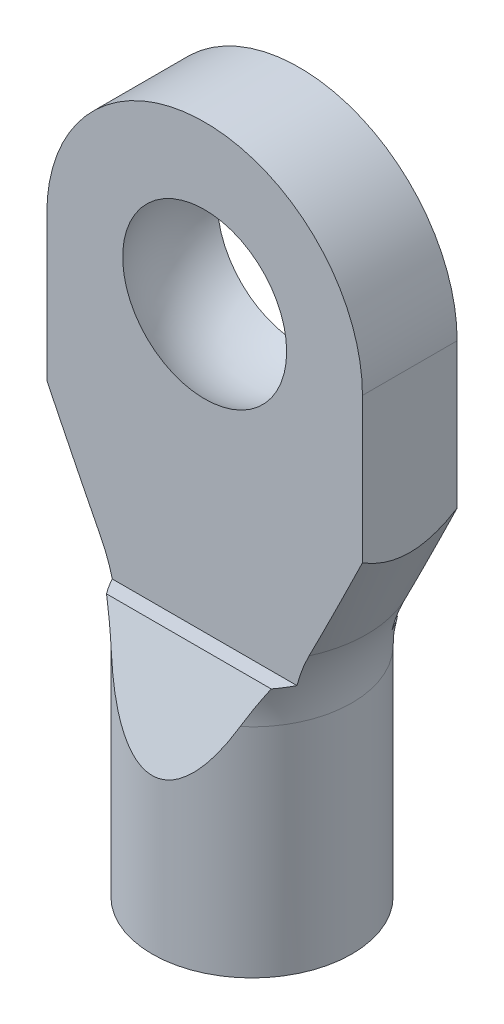
from build123d import *

# Parameters (mm, degrees)
BOSS_EXTRUDE1_DEPTH      = 1.5
BOSS_EXTRUDE1_DEPTH_BACK = 1.5
SKETCH3_R                = 3.5
BOSS_EXTRUDE2_DEPTH      = 8
CUT_EXTRUDE2_DEPTH       = 23.830900114
CUT_EXTRUDE2_DEPTH_BACK  = 23.830900114
SKETCH8_R                = 1.75
CUT_EXTRUDE3_DEPTH       = 5


with BuildPart() as part:
    # Sketch1 → Boss-Extrude1 (new, two sides: drawn at the far end of the back side and taken through both)
    with BuildSketch(Plane.XY.offset(-BOSS_EXTRUDE1_DEPTH_BACK)):
        with BuildLine():
            Line((-3.5, 8.5), (-3.5, 0))
            Line((-3.5, 0), (3.5, 0))
            Line((3.5, 0), (3.5, 8.5))
            Line((3.5, 8.5), (5, 11.8))
            Line((5, 11.8), (5, 17))
            ThreePointArc((5, 17), (0, 22), (-5, 17))
            Line((-5, 17), (-5, 11.8))
            Line((-5, 11.8), (-3.5, 8.5))
        make_face()
    extrude(amount=BOSS_EXTRUDE1_DEPTH + BOSS_EXTRUDE1_DEPTH_BACK)

    # Sketch3 → Boss-Extrude2 (add)
    with BuildSketch(Plane(origin=(0, 0, 0), x_dir=(1, 0, 0), z_dir=(0, 1, 0))):
        Circle(SKETCH3_R)
    extrude(amount=BOSS_EXTRUDE2_DEPTH)

    # Sketch5 → Cut-Extrude2 (cut, two sides: drawn at the far end of the back side and taken through both)
    with BuildSketch(Plane(origin=(0, 0, 0), x_dir=(0, 0, -1), z_dir=(1, 0, 0)).offset(-CUT_EXTRUDE2_DEPTH_BACK)):
        Polygon((2, 8), (3.5, 4), (3.5, 8), align=None)
        Polygon((-3.5, 8), (-2, 8), (-3.5, 4), align=None)
    extrude(amount=CUT_EXTRUDE2_DEPTH + CUT_EXTRUDE2_DEPTH_BACK, mode=Mode.SUBTRACT)

    # Sketch6 → Cut-Revolve1 (revolve, cut)
    with BuildSketch(Plane.XY):
        with BuildLine():
            Line((7.363636364, 17), (3.631624104, 9.005417126))
            ThreePointArc((3.631624104, 9.005417126), (3.281024349, 7.973648404), (3.16227766, 6.890428154))
            Line((3.16227766, 6.890428154), (3.16227766, 0))
            Line((3.16227766, 0), (7.363636364, 0))
            Line((7.363636364, 0), (7.363636364, 17))
        make_face()
    revolve(axis=Axis((0, 0, 0), (0, 1, 0)), mode=Mode.SUBTRACT)

    # Sketch7 → Cut-Revolve2 (revolve, cut)
    with BuildSketch(Plane.XY):
        with BuildLine():
            Line((0, 20), (0, 14))
            ThreePointArc((0, 14), (3, 17), (0, 20))
        make_face()
    revolve(axis=Axis((0, 0, 0), (0, 1, 0)), mode=Mode.SUBTRACT)

    # Sketch8 → Cut-Extrude3 (cut)
    with BuildSketch(Plane.XZ):
        Circle(SKETCH8_R)
    extrude(amount=-CUT_EXTRUDE3_DEPTH, mode=Mode.SUBTRACT)


solid = part.part
